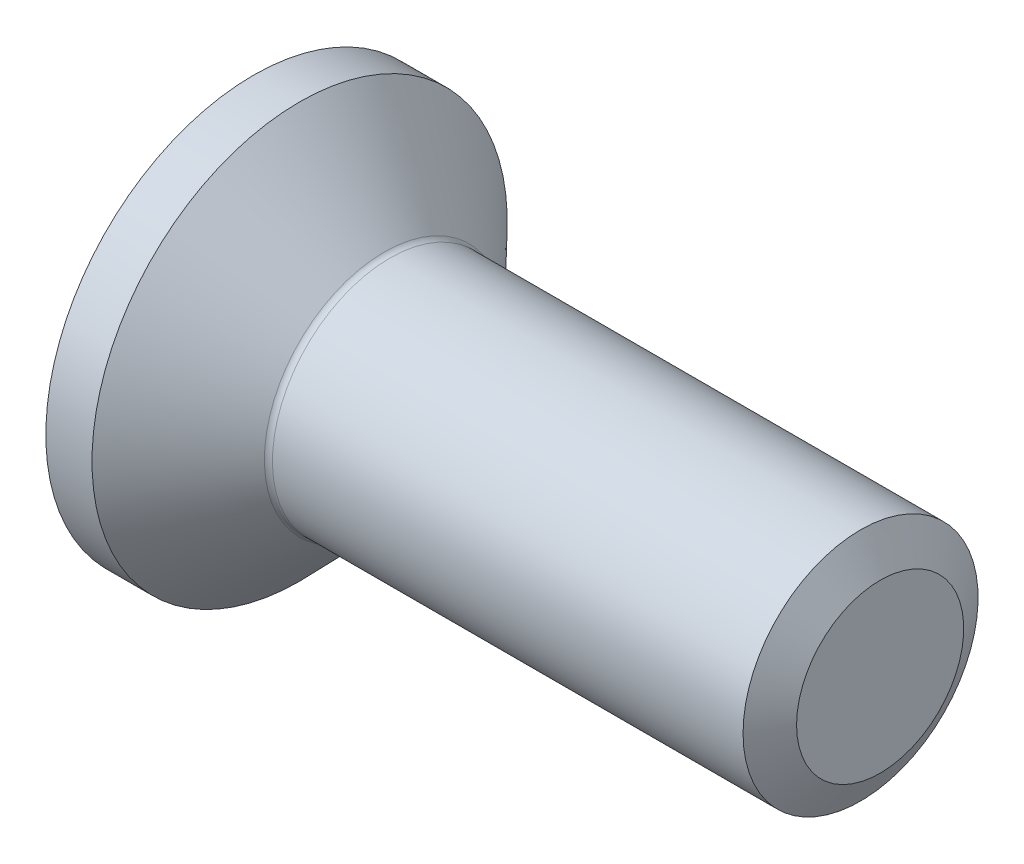
from build123d import *

# Parameters (mm, degrees)
CUT_EXTRUDE_1_DEPTH = 1.86


with BuildPart() as part:
    # 草图1 → 旋转1 (revolve)
    with BuildSketch(Plane.XY):
        with BuildLine():
            Line((0, 1.5), (-6.257552518, 1.5))
            ThreePointArc((-6.257552518, 1.5), (-6.296625631, 1.507949515), (-6.329486498, 1.530534163))
            Line((-6.329486498, 1.530534163), (-7.410542091, 2.65))
            Line((-7.410542091, 2.65), (-8, 2.65))
            Line((-8, 2.65), (-8, 0))
            Line((-8, 0), (0, 0))
            Line((0, 0), (0, 1.5))
        make_face()
    revolve(axis=Axis((0, 0, 0), (-1, 0, 0)))

    # 草图2 → 切除-拉伸1 (cut)
    with BuildSketch(Plane.ZY.offset(8)):
        Polygon((0, 1.154700538), (-1, 0.577350269), (-1, -0.577350269), (0, -1.154700538), (1, -0.577350269), (1, 0.577350269), align=None)
    extrude(amount=-CUT_EXTRUDE_1_DEPTH, mode=Mode.SUBTRACT)

    # 草图6 → 旋转2 (revolve)
    with BuildSketch(Plane.XY):
        Polygon((-6.9, 1.154700538), (-6.233333333, 0), (-5.84, 0), (-5.84, 1.154700538), align=None)
    revolve(axis=Axis((-8, 0, 0), (1, 0, 0)))

    # 草图7 → 切除-旋转2 (revolve, cut)
    with BuildSketch(Plane.XY):
        Polygon((-8, 1.154700538), (-8, 0), (-7.7, 0), align=None)
    revolve(axis=Axis((-8, 0, 0), (1, 0, 0)), mode=Mode.SUBTRACT)

    # 草图4 → 切除-旋转1 (revolve, cut)
    with BuildSketch(Plane.XY):
        Polygon((-0.25, 1.5), (0, 1.066987298), (0.25, 1.5), align=None)
    revolve(axis=Axis((-0.25, 0, 0), (1, 0, 0)), mode=Mode.SUBTRACT)


solid = part.part
